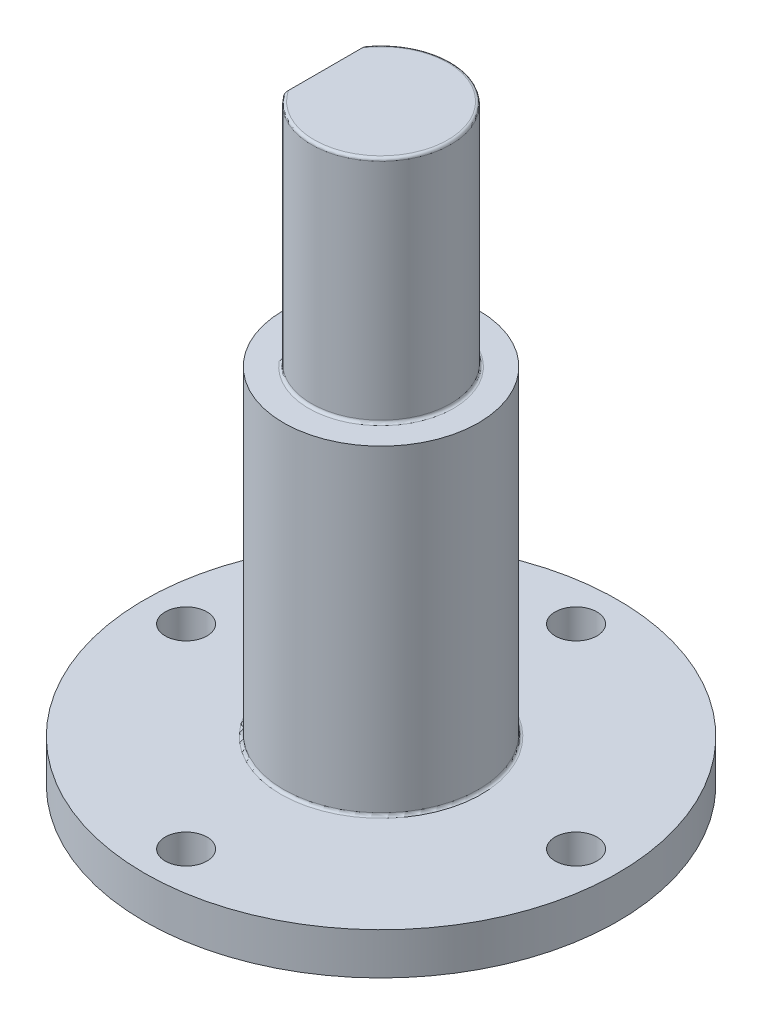
from build123d import *

# Parameters (mm, degrees)
SKETCH_1_R      = 17
SKETCH_1_R_2    = 1.5
EXTRUDE_1_DEPTH = 3
SKETCH_2_R      = 7
EXTRUDE_2_DEPTH = 23
EXTRUDE_3_DEPTH = 16.5
FILLET_1_R      = 0.2


with BuildPart() as part:
    # 草图1 → 凸台-拉伸1 (new body)
    with BuildSketch(Plane(origin=(0, 0, 0), x_dir=(1, 0, 0), z_dir=(0, 1, 0))):
        with Locations(Location((0, 0, 0), (0, 0, 270))):
            Circle(SKETCH_1_R)
        with Locations(Location((0, 14, 0), (0, 0, 270))):
            Circle(SKETCH_1_R_2, mode=Mode.SUBTRACT)
        with Locations(Location((14, 0, 0), (0, 0, 270))):
            Circle(SKETCH_1_R_2, mode=Mode.SUBTRACT)
        with Locations(Location((0, -14, 0), (0, 0, 270))):
            Circle(SKETCH_1_R_2, mode=Mode.SUBTRACT)
        with Locations(Location((-14, 0, 0), (0, 0, 270))):
            Circle(SKETCH_1_R_2, mode=Mode.SUBTRACT)
    extrude(amount=EXTRUDE_1_DEPTH)

    # 草图2 → 凸台-拉伸2 (add)
    with BuildSketch(Plane(origin=(0, 3, 0), x_dir=(1, 0, 0), z_dir=(0, 1, 0))):
        with Locations(Location((0, 0, 0), (0, 0, 270))):
            Circle(SKETCH_2_R)
    extrude(amount=EXTRUDE_2_DEPTH)

    # 草图3 → 凸台-拉伸3 (add)
    with BuildSketch(Plane(origin=(0, 26, 0), x_dir=(1, 0, 0), z_dir=(0, 1, 0))):
        with BuildLine():
            Line((-4, 0), (-4, 3))
            ThreePointArc((-4, 3), (5, 0), (-4, -3))
            Line((-4, -3), (-4, 0))
        make_face()
    extrude(amount=EXTRUDE_3_DEPTH)

    # 圆角1
    fillet_1_edges = [part.edges().sort_by_distance(p)[0] for p in [
        (0, 3, -7),
        (5, 26, 0),
        (5, 42.5, 0),
    ]]
    fillet(fillet_1_edges, radius=FILLET_1_R)


solid = part.part
